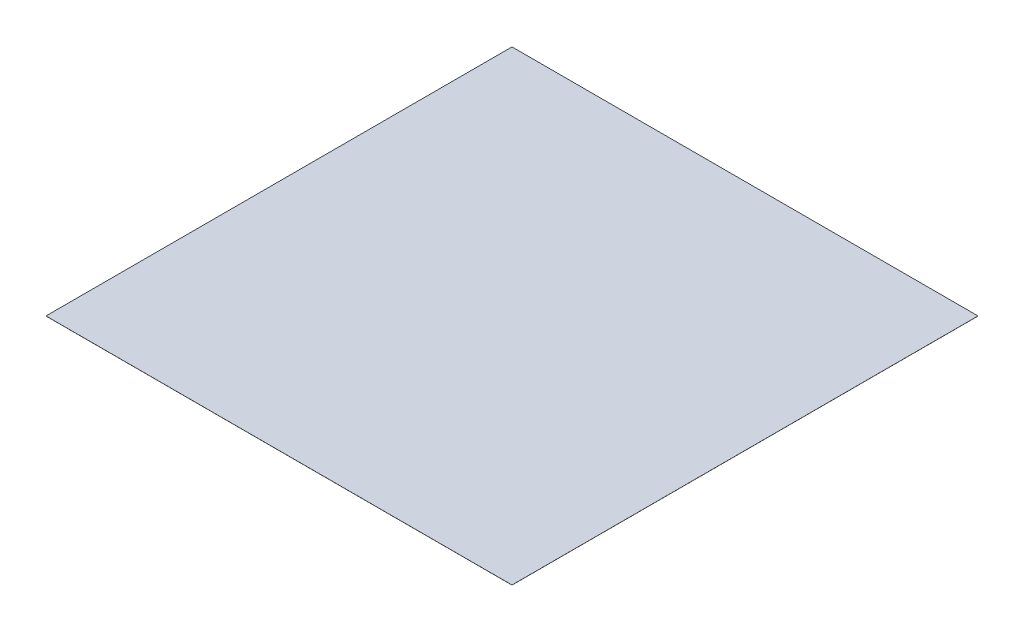
from build123d import *

# Parameters (mm, degrees)
SKETCH_1_W      = 1000
SKETCH_1_H      = 1000
EXTRUDE_1_DEPTH = 0.2


with BuildPart() as part:
    # 草图1 → 凸台-拉伸1 (new body)
    with BuildSketch(Plane(origin=(0, 0, 0), x_dir=(1, 0, 0), z_dir=(0, 1, 0))):
        Rectangle(SKETCH_1_W, SKETCH_1_H)
    extrude(amount=EXTRUDE_1_DEPTH)


solid = part.part
